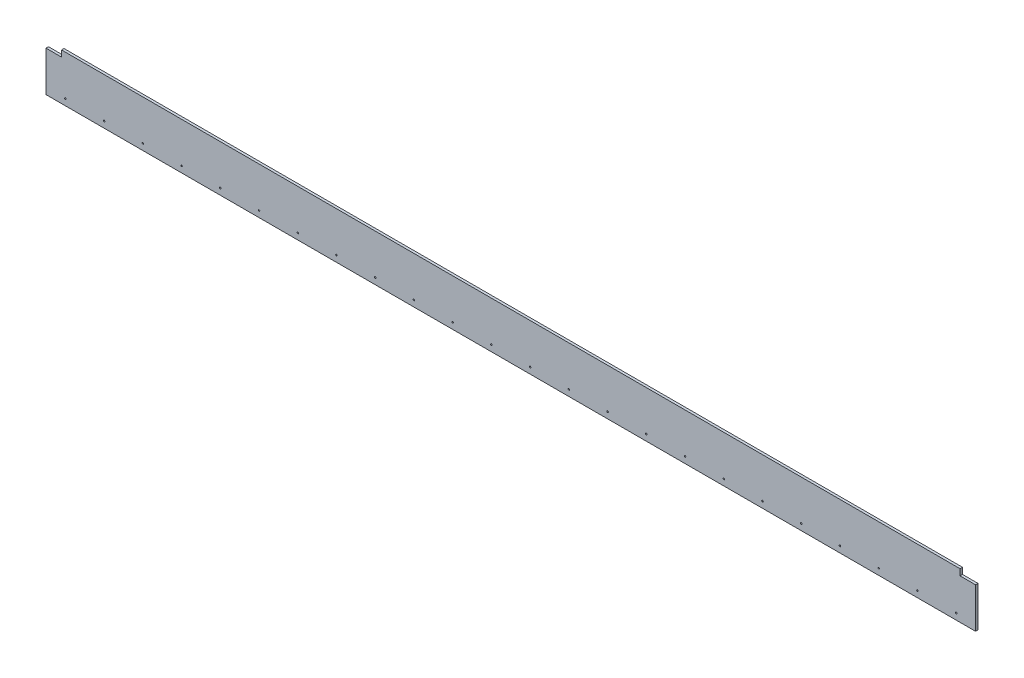
from build123d import *

# Parameters (mm, degrees)
ESQUISSE1_W                = 600
ESQUISSE1_H                = 30
BOSS_EXTRU_1_DEPTH         = 1.6
ESQUISSE5_R                = 0.5
ENL_V_MAT_EXTRU_2_DEPTH    = 50
R_P_TITION_LIN_AIRE3_COUNT = 24
R_P_TITION_LIN_AIRE3_PITCH = 25
ESQUISSE6_W                = 10
ESQUISSE6_H                = 4
ENL_V_MAT_EXTRU_3_DEPTH    = 30


with BuildPart() as part:
    # Esquisse1 → Boss.-Extru.1 (new body)
    with BuildSketch(Plane.XY):
        with Locations((300, 15)):
            Rectangle(ESQUISSE1_W, ESQUISSE1_H)
    extrude(amount=BOSS_EXTRU_1_DEPTH)

    # Esquisse5 → Enlèv. mat.-Extru.2 (cut)
    with BuildSketch(Plane(origin=(0, 0, 0), x_dir=(-1, 0, 0), z_dir=(0, 0, -1))):
        with Locations((-587.5, 4)):
            Circle(ESQUISSE5_R)
    enl_v_mat_extru_2 = extrude(amount=-ENL_V_MAT_EXTRU_2_DEPTH, mode=Mode.SUBTRACT)

    # Répétition linéaire3: Enlèv. mat.-Extru.2 ×24
    with Locations(*[(-i * R_P_TITION_LIN_AIRE3_PITCH, 0, 0) for i in range(1, R_P_TITION_LIN_AIRE3_COUNT)]):
        add(enl_v_mat_extru_2, mode=Mode.SUBTRACT)

    # Esquisse6 → Enlèv. mat.-Extru.3 (cut)
    with BuildSketch(Plane(origin=(0, 0, 0), x_dir=(-1, 0, 0), z_dir=(0, 0, -1))):
        with Locations((-595, 28)):
            Rectangle(ESQUISSE6_W, ESQUISSE6_H)
        with Locations((-5, 28)):
            Rectangle(ESQUISSE6_W, ESQUISSE6_H)
    extrude(amount=-ENL_V_MAT_EXTRU_3_DEPTH, mode=Mode.SUBTRACT)


solid = part.part
